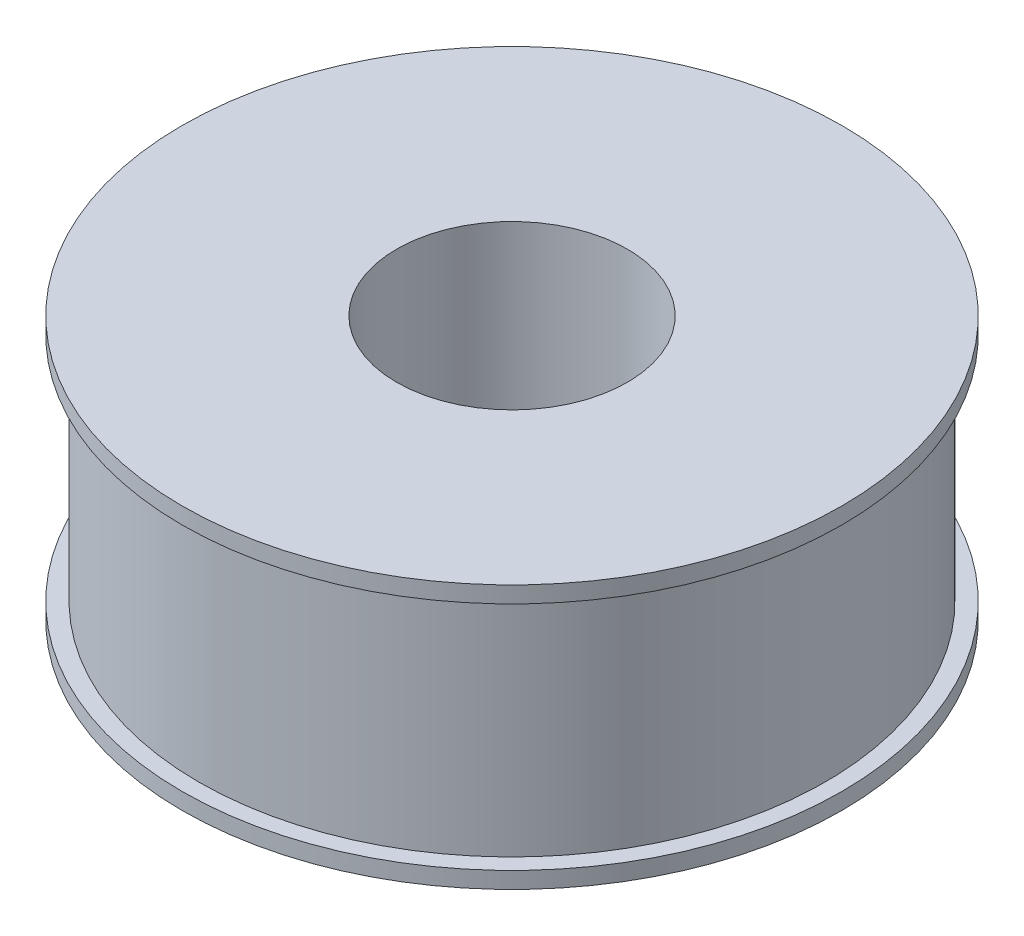
from build123d import *

# Parameters (mm, degrees)
SKETCH2_R           = 10
SKETCH2_R_2         = 3.5
BOSS_EXTRUDE1_DEPTH = 8
SKETCH3_W           = 1
SKETCH3_H           = 7


with BuildPart() as part:
    # Sketch2 → Boss-Extrude1 (new body)
    with BuildSketch(Plane(origin=(0, 0, 0), x_dir=(1, 0, 0), z_dir=(0, 1, 0))):
        with Locations(Location((0, 0, 0), (0, 0, 270))):
            Circle(SKETCH2_R)
        with Locations(Location((0, 0, 0), (0, 0, 270))):
            Circle(SKETCH2_R_2, mode=Mode.SUBTRACT)
    extrude(amount=BOSS_EXTRUDE1_DEPTH)

    # Sketch3 → Cut-Revolve1 (revolve, cut)
    with BuildSketch(Plane.XY, mode=Mode.PRIVATE) as cut_revolve1_sk:
        with Locations((-10, 4)):
            Rectangle(SKETCH3_W, SKETCH3_H)
    revolve(cut_revolve1_sk.sketch.rotate(Axis((0, 8, 0), (0, -1, 0)), 270), axis=Axis((0, 8, 0), (0, -1, 0)), mode=Mode.SUBTRACT)


solid = part.part
